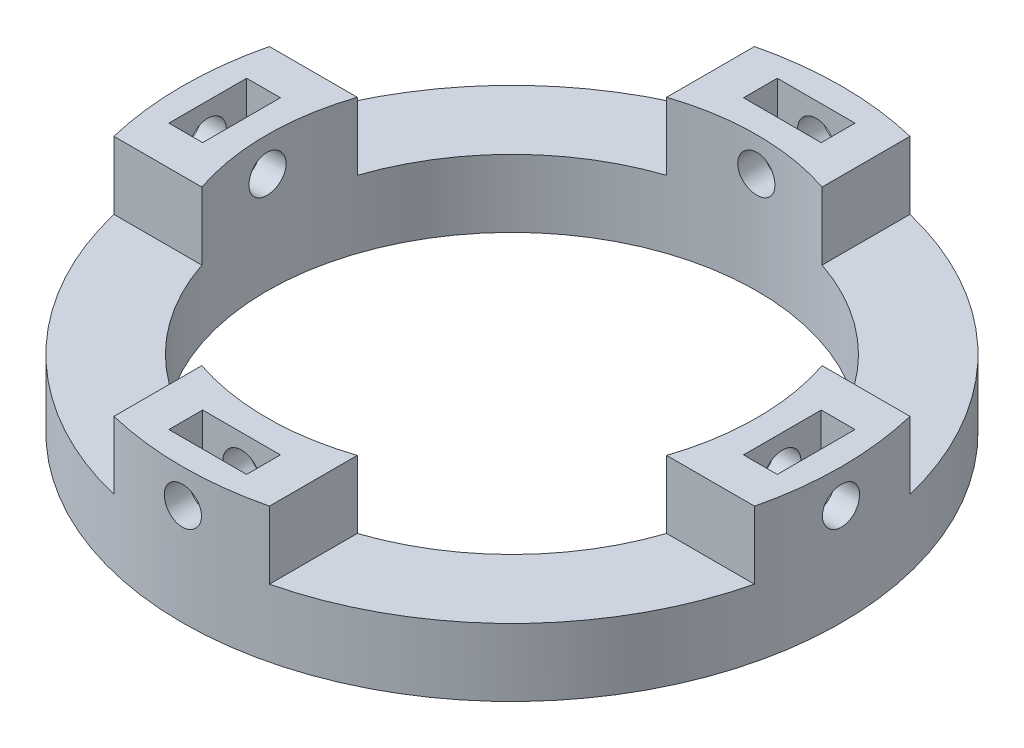
from build123d import *
from build123d.topology import SkipClean

# Parameters (mm, degrees)
SKETCH_1_R               = 19.5
SKETCH_1_R_2             = 14.5
EXTRUDE_1_DEPTH          = 4
SKETCH_3_W               = 4.6
SKETCH_3_H               = 2
SKETCH_3_W_2             = 2
SKETCH_3_H_2             = 4.6
EXTRUDE_3_DEPTH          = 4
SKETCH_12_R              = 1.1
CUT_EXTRUDE_2_DEPTH      = 44.017438324
PATTERN_CIRCULAR_2_COUNT = 2
PATTERN_CIRCULAR_2_ANGLE = 90


with BuildPart() as part:
    # Эскиз1 → Бобышка-Вытянуть1 (new body)
    with BuildSketch(Plane(origin=(0, 0, 0), x_dir=(1, 0, 0), z_dir=(0, 1, 0))):
        with Locations(Location((0, 0, 0), (0, 0, 270))):
            Circle(SKETCH_1_R)
        with Locations(Location((0, 0, 0), (0, 0, 270))):
            Circle(SKETCH_1_R_2, mode=Mode.SUBTRACT)
    extrude(amount=EXTRUDE_1_DEPTH)

    # Эскиз3 → Бобышка-Вытянуть3 (add)
    # profile 1 of 4: a face of its own
    with SkipClean():  # the faces are left unmerged after this step: merging them gives an invalid solid
        with BuildSketch(Plane(origin=(0, 4, 0), x_dir=(1, 0, 0), z_dir=(0, 1, 0))):
            with BuildLine():
                Line((-4.599991072, 18.949672349), (-4.599991072, 13.75100295))
                ThreePointArc((-4.599991072, 13.75100295), (0, 14.5), (4.599991072, 13.75100295))
                Line((4.599991072, 13.75100295), (4.599991072, 18.949672349))
                ThreePointArc((4.599991072, 18.949672349), (0, 19.5), (-4.599991072, 18.949672349))
            make_face()
            with Locations((0, 17)):
                Rectangle(SKETCH_3_W, SKETCH_3_H, mode=Mode.SUBTRACT)
        # profile 2 of 4: a face of its own
        with BuildSketch(Plane(origin=(0, 4, 0), x_dir=(1, 0, 0), z_dir=(0, 1, 0))):
            with BuildLine():
                Line((18.949672349, 4.599991072), (13.75100295, 4.599991072))
                ThreePointArc((13.75100295, 4.599991072), (14.5, 0), (13.75100295, -4.599991072))
                Line((13.75100295, -4.599991072), (18.949672349, -4.599991072))
                ThreePointArc((18.949672349, -4.599991072), (19.5, 0), (18.949672349, 4.599991072))
            make_face()
            with Locations((17, 0)):
                Rectangle(SKETCH_3_W_2, SKETCH_3_H_2, mode=Mode.SUBTRACT)
        # profile 3 of 4: a face of its own
        with BuildSketch(Plane(origin=(0, 4, 0), x_dir=(1, 0, 0), z_dir=(0, 1, 0))):
            with BuildLine():
                Line((4.599991072, -18.949672349), (4.599991072, -13.75100295))
                ThreePointArc((4.599991072, -13.75100295), (0, -14.5), (-4.599991072, -13.75100295))
                Line((-4.599991072, -13.75100295), (-4.599991072, -18.949672349))
                ThreePointArc((-4.599991072, -18.949672349), (0, -19.5), (4.599991072, -18.949672349))
            make_face()
            with Locations((0, -17)):
                Rectangle(SKETCH_3_W, SKETCH_3_H, mode=Mode.SUBTRACT)
        # profile 4 of 4: a face of its own
        with BuildSketch(Plane(origin=(0, 4, 0), x_dir=(1, 0, 0), z_dir=(0, 1, 0))):
            with BuildLine():
                Line((-18.949672349, -4.599991072), (-13.75100295, -4.599991072))
                ThreePointArc((-13.75100295, -4.599991072), (-14.5, 0), (-13.75100295, 4.599991072))
                Line((-13.75100295, 4.599991072), (-18.949672349, 4.599991072))
                ThreePointArc((-18.949672349, 4.599991072), (-19.5, 0), (-18.949672349, -4.599991072))
            make_face()
            with Locations((-17, 0)):
                Rectangle(SKETCH_3_W_2, SKETCH_3_H_2, mode=Mode.SUBTRACT)
        extrude(amount=EXTRUDE_3_DEPTH)

    # Эскиз12 → Вырез-Вытянуть2 (cut, symmetric)
    with SkipClean():  # the faces are left unmerged after this step: merging them gives an invalid solid
        with BuildSketch(Plane.XY.offset(-18)):
            with Locations((0, 6)):
                Circle(SKETCH_12_R)
        cut_extrude_2 = extrude(amount=CUT_EXTRUDE_2_DEPTH, both=True, mode=Mode.SUBTRACT)

    # Круговой массив2: Вырез-Вытянуть2 ×2 about axis
    with SkipClean():  # the faces are left unmerged after this step: merging them gives an invalid solid
        pattern_circular_2_axis = Axis((0, 4, 0), (0, -1, 0))
        for i in range(1, PATTERN_CIRCULAR_2_COUNT):
            add(cut_extrude_2.rotate(pattern_circular_2_axis, i * PATTERN_CIRCULAR_2_ANGLE / (PATTERN_CIRCULAR_2_COUNT - 1)), mode=Mode.SUBTRACT)


solid = part.part
